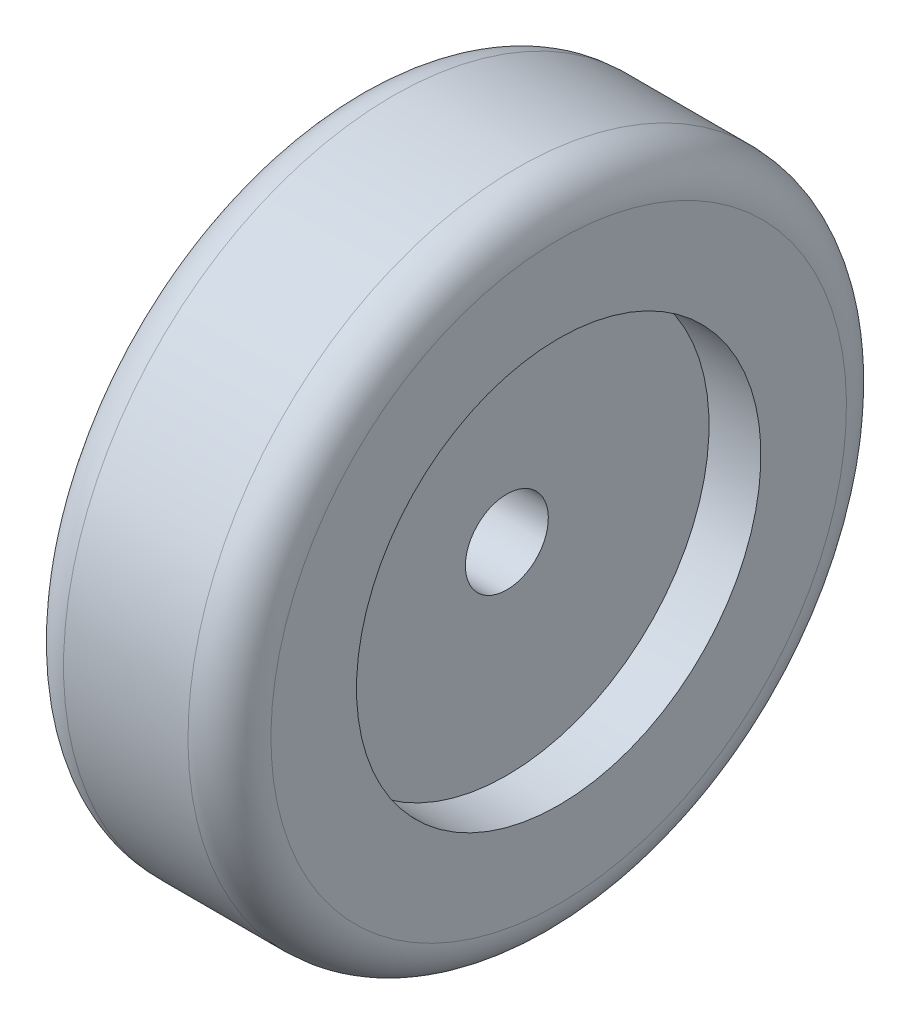
from build123d import *

# Parameters (mm, degrees)
CROQUIS2_R            = 4
CORTAR_EXTRUIR1_DEPTH = 51.449231907
REDONDEO1_R           = 4


with BuildPart() as part:
    # Croquis1 → Revolución1 (revolve)
    with BuildSketch(Plane.XY, mode=Mode.PRIVATE) as revoluci_n1_sk:
        Polygon((0, 0), (0, 19.5), (5, 19.5), (5, 31.75), (-15, 31.75), (-15, 19.5), (-18, 10), (-18, 0), align=None)
    revolve(revoluci_n1_sk.sketch.rotate(Axis((-18, 0, 0), (1, 0, 0)), 180), axis=Axis((-18, 0, 0), (1, 0, 0)))

    # Croquis2 → Cortar-Extruir1 (cut, through all)
    with BuildSketch(Plane.ZY.offset(18)):
        with Locations(Location((0, 0, 0), (0, 0, 270))):
            Circle(CROQUIS2_R)
    extrude(amount=-CORTAR_EXTRUIR1_DEPTH, mode=Mode.SUBTRACT)

    # Redondeo1
    redondeo1_edges = [part.edges().sort_by_distance(p)[0] for p in [
        (-15, 31.75, 0),
        (5, 31.75, 0),
    ]]
    fillet(redondeo1_edges, radius=REDONDEO1_R)


solid = part.part
